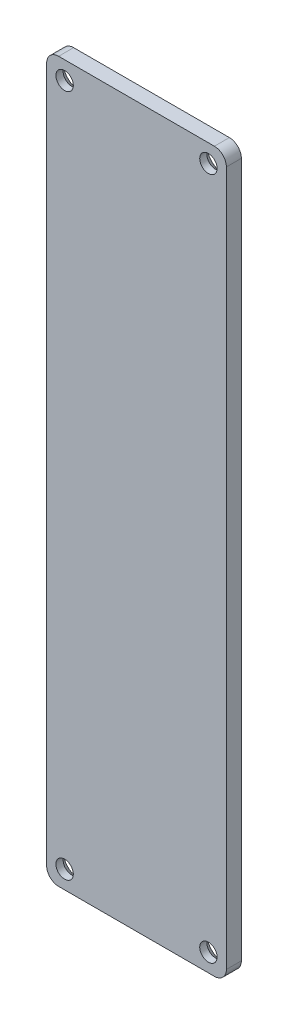
from build123d import *

# Parameters (mm, degrees)
BOSS_EXTRUDE1_DEPTH                          = 2.5
CSK_FOR_M2_5_COUNTERSUNK_FLAT_HEAD_S_2_COUNT = 2
CSK_FOR_M2_5_COUNTERSUNK_FLAT_HEAD_S_2_PITCH = 24
CSK_FOR_M2_5_COUNTERSUNK_FLAT_HEAD_S_3_COUNT = 2
CSK_FOR_M2_5_COUNTERSUNK_FLAT_HEAD_S_3_PITCH = 114
CSK_FOR_M2_5_COUNTERSUNK_FLAT_HEAD_S_4_COUNT = 2
CSK_FOR_M2_5_COUNTERSUNK_FLAT_HEAD_S_4_PITCH = 116.498927034


with BuildPart() as part:
    # Sketch1 → Boss-Extrude1 (new body)
    with BuildSketch(Plane.XY):
        with BuildLine():
            Line((-63.122572744, 90.432106023), (-63.122572744, -25.567893977))
            ThreePointArc((-63.122572744, -25.567893977), (-63.708359182, -26.98210754), (-65.122572744, -27.567893977))
            Line((-65.122572744, -27.567893977), (-91.122572744, -27.567893977))
            ThreePointArc((-91.122572744, -27.567893977), (-92.536786306, -26.98210754), (-93.122572744, -25.567893977))
            Line((-93.122572744, -25.567893977), (-93.122572744, 90.432106023))
            ThreePointArc((-93.122572744, 90.432106023), (-92.536786306, 91.846319585), (-91.122572744, 92.432106023))
            Line((-91.122572744, 92.432106023), (-65.122572744, 92.432106023))
            ThreePointArc((-65.122572744, 92.432106023), (-63.708359182, 91.846319585), (-63.122572744, 90.432106023))
        make_face()
    extrude(amount=BOSS_EXTRUDE1_DEPTH)

    # Sketch3 → CSK for M2.5 Countersunk Flat Head Screw2 (revolve, cut)
    with BuildSketch(Plane(origin=(-66.122572744, 89.432106023, 0), x_dir=(0, 1, 0), z_dir=(1, 0, 0))):
        Polygon((0, 0), (0, 2.5), (1.45, 2.5), (1.45, 1.3), (2.75, 0), align=None)
    csk_for_m2_5_countersunk_flat_head_screw = revolve(axis=Axis((-66.122572744, 89.432106023, -6.35), (0, 0, 1)), mode=Mode.SUBTRACT)

    # CSK for M2.5 Countersunk Flat Head S 2: CSK for M2.5 Countersunk Flat Head Screw2 ×2
    with Locations(*[(-i * CSK_FOR_M2_5_COUNTERSUNK_FLAT_HEAD_S_2_PITCH, 0, 0) for i in range(1, CSK_FOR_M2_5_COUNTERSUNK_FLAT_HEAD_S_2_COUNT)]):
        add(csk_for_m2_5_countersunk_flat_head_screw, mode=Mode.SUBTRACT)

    # CSK for M2.5 Countersunk Flat Head S 3: CSK for M2.5 Countersunk Flat Head Screw2 ×2
    with Locations(*[(0, -i * CSK_FOR_M2_5_COUNTERSUNK_FLAT_HEAD_S_3_PITCH, 0) for i in range(1, CSK_FOR_M2_5_COUNTERSUNK_FLAT_HEAD_S_3_COUNT)]):
        add(csk_for_m2_5_countersunk_flat_head_screw, mode=Mode.SUBTRACT)

    # CSK for M2.5 Countersunk Flat Head S 4: CSK for M2.5 Countersunk Flat Head Screw2 ×2
    with Locations(*[Vector(-0.20601048104984201, -0.978549784986749, 0) * (i * CSK_FOR_M2_5_COUNTERSUNK_FLAT_HEAD_S_4_PITCH) for i in range(1, CSK_FOR_M2_5_COUNTERSUNK_FLAT_HEAD_S_4_COUNT)]):
        add(csk_for_m2_5_countersunk_flat_head_screw, mode=Mode.SUBTRACT)


solid = part.part
